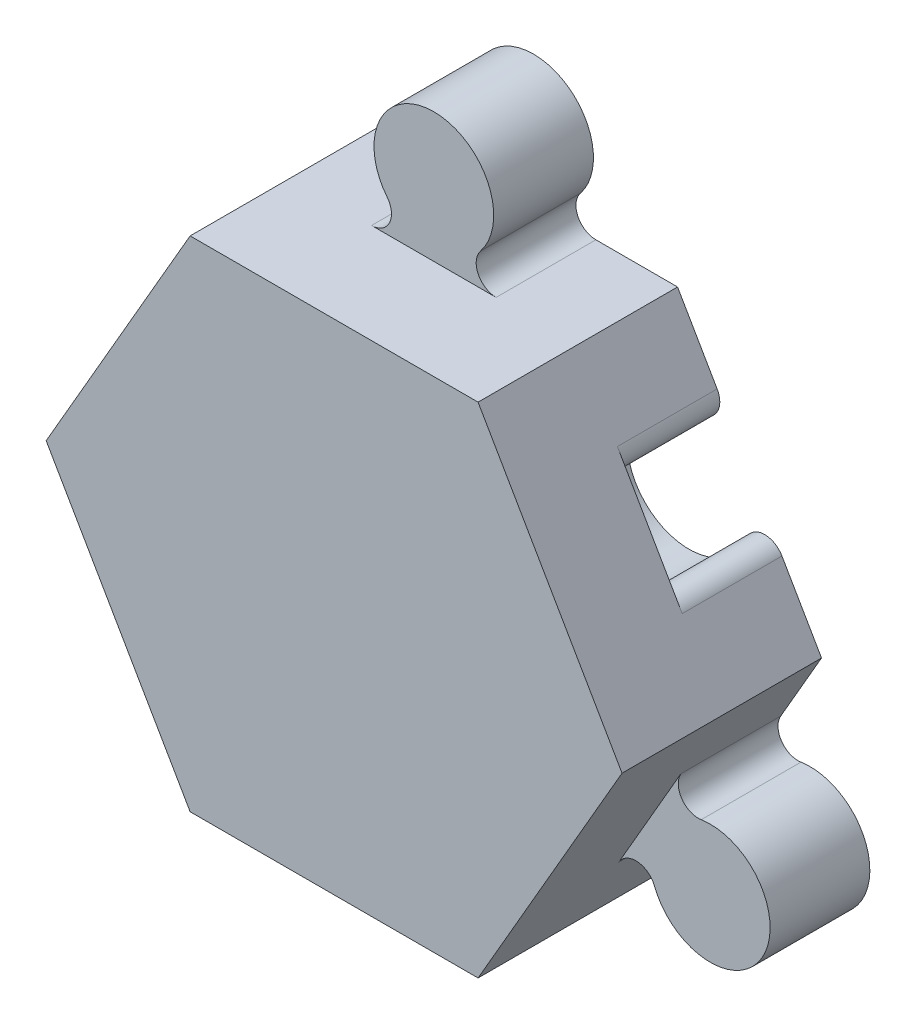
from build123d import *

# Parameters (mm, degrees)
EXTRUDE_1_DEPTH          = 10
EXTRUDE_2_DEPTH          = 5
CUT_EXTRUDE_2_DEPTH      = 5
PATTERN_CIRCULAR_1_COUNT = 3


with BuildPart() as part:
    # 草图1 → 凸台-拉伸1 (new body)
    with BuildSketch(Plane.XY):
        Polygon((14.43375673, 0), (7.216878365, 12.5), (-7.216878365, 12.5), (-14.43375673, 0), (-7.216878365, -12.5), (7.216878365, -12.5), align=None)
    extrude(amount=EXTRUDE_1_DEPTH)

    # 草图2 → 凸台-拉伸2 (add)
    with BuildSketch(Plane(origin=(0, 0, 0), x_dir=(-1, 0, 0), z_dir=(0, 0, -1))):
        with BuildLine():
            Line((-3.122498999, 12.5), (3.122498999, 12.5))
            ThreePointArc((3.122498999, 12.5), (2.22111118, 13.066987298), (2.341874249, 14.125))
            ThreePointArc((2.341874249, 14.125), (0, 19), (-2.341874249, 14.125))
            ThreePointArc((-2.341874249, 14.125), (-2.22111118, 13.066987298), (-3.122498999, 12.5))
        make_face()
    extrude_2 = extrude(amount=-EXTRUDE_2_DEPTH)

    # 草图3 → 切除-拉伸2 (cut)
    with BuildSketch(Plane(origin=(0, 0, 0), x_dir=(-1, 0, 0), z_dir=(0, 0, -1))):
        with BuildLine():
            ThreePointArc((-2.457026249, -10.890243902), (-2.352465403, -11.941726104), (-3.249615362, -12.5))
            Line((-3.249615362, -12.5), (0, -12.5))
            Line((0, -12.5), (3.249615362, -12.5))
            ThreePointArc((3.249615362, -12.5), (2.352465403, -11.941726104), (2.457026249, -10.890243902))
            ThreePointArc((2.457026249, -10.890243902), (0, -5.9), (-2.457026249, -10.890243902))
        make_face()
    cut_extrude_2 = extrude(amount=-CUT_EXTRUDE_2_DEPTH, mode=Mode.SUBTRACT)

    # 阵列(圆周)1: 凸台-拉伸2, 切除-拉伸2 ×3 about axis
    pattern_circular_1_axis = Axis((0, 0, 0), (0, 0, -1))
    add([extrude_2.rotate(pattern_circular_1_axis, i * 360 / PATTERN_CIRCULAR_1_COUNT) for i in range(1, PATTERN_CIRCULAR_1_COUNT)])
    add([cut_extrude_2.rotate(pattern_circular_1_axis, i * 360 / PATTERN_CIRCULAR_1_COUNT) for i in range(1, PATTERN_CIRCULAR_1_COUNT)], mode=Mode.SUBTRACT)


solid = part.part
